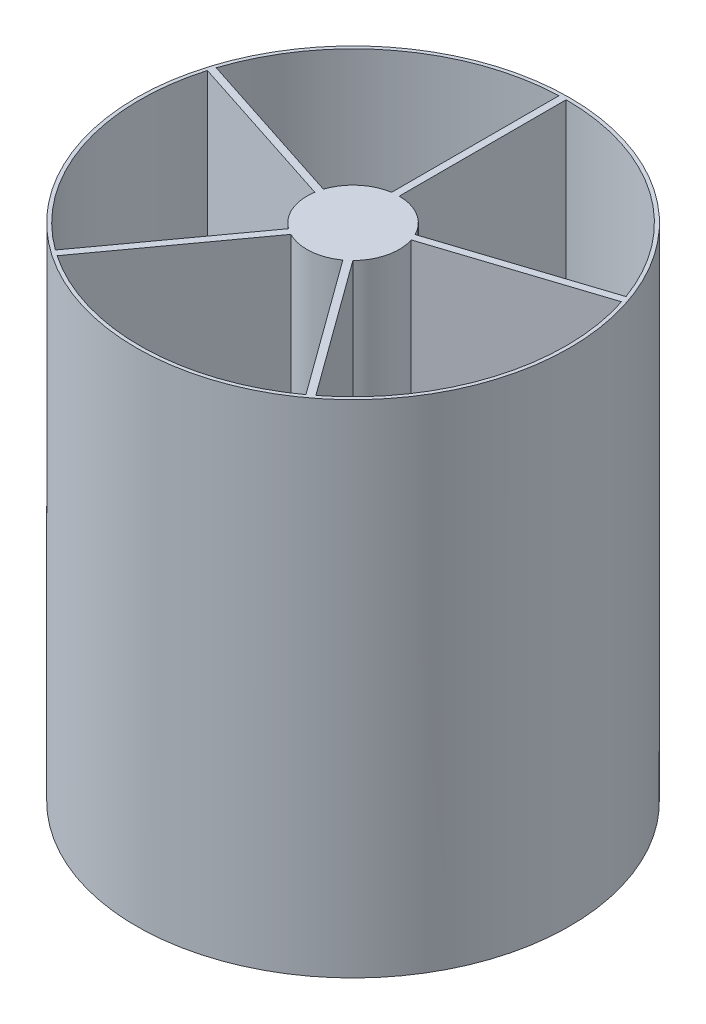
from build123d import *

# Parameters (mm, degrees)
SKETCH3_R           = 305
SKETCH3_R_2         = 300
SKETCH3_R_3         = 65
SKETCH3_R_4         = 60
BOSS_EXTRUDE1_DEPTH = 700
BOSS_EXTRUDE2_START = 5
SKETCH4_R           = 305
BOSS_EXTRUDE2_DEPTH = 5
BOSS_EXTRUDE3_START = -5
SKETCH5_R           = 60
BOSS_EXTRUDE3_DEPTH = 5


with BuildPart() as part:
    # Sketch3 → Boss-Extrude1 (new body)
    # profile 1 of 7: a face of its own
    with BuildSketch(Plane(origin=(0, 0, 0), x_dir=(1, 0, 0), z_dir=(0, 1, 0))):
        with Locations(Location((0, 0, 0), (0, 0, 270))):
            Circle(SKETCH3_R)
        Circle(SKETCH3_R_2, mode=Mode.SUBTRACT)
    # profile 2 of 7: a face of its own
    with BuildSketch(Plane(origin=(0, 0, 0), x_dir=(1, 0, 0), z_dir=(0, 1, 0))):
        with BuildLine():
            Line((184.327754195, -236.692372149), (45.841361304, -46.082204741))
            ThreePointArc((45.841361304, -46.082204741), (42.149337524, -49.48164656), (38.206041399, -52.586104634))
            Line((38.206041399, -52.586104634), (176.335575688, -242.705098312))
            ThreePointArc((176.335575688, -242.705098312), (180.356723189, -239.732042915), (184.327754195, -236.692372149))
        make_face()
    # profile 3 of 7: a face of its own
    with BuildSketch(Plane(origin=(0, 0, 0), x_dir=(1, 0, 0), z_dir=(0, 1, 0))):
        with BuildLine():
            Line((282.068231471, 102.164146329), (57.992540793, 29.35754098))
            ThreePointArc((57.992540793, 29.35754098), (60.084703994, 24.795732413), (61.818673559, 20.086104634))
            Line((61.818673559, 20.086104634), (285.316954889, 92.705098312))
            ThreePointArc((285.316954889, 92.705098312), (283.732014095, 97.44816149), (282.068231471, 102.164146329))
        make_face()
    # profile 4 of 7: a face of its own
    with BuildSketch(Plane(origin=(0, 0, 0), x_dir=(1, 0, 0), z_dir=(0, 1, 0))):
        with BuildLine():
            ThreePointArc((-29.661021416, -57.837909787), (-34.034980801, -55.377071807), (-38.206041399, -52.586104634))
            Line((-38.206041399, -52.586104634), (-176.335575688, -242.705098312))
            ThreePointArc((-176.335575688, -242.705098312), (-172.265429064, -245.610712204), (-168.147414308, -248.448077194))
            Line((-168.147414308, -248.448077194), (-29.661021416, -57.837909787))
        make_face()
    # profile 5 of 7: a face of its own
    with BuildSketch(Plane(origin=(0, 0, 0), x_dir=(1, 0, 0), z_dir=(0, 1, 0))):
        Circle(SKETCH3_R_3)
        with Locations(Location((0, 0, 0), (0, 0, 270))):
            Circle(SKETCH3_R_4, mode=Mode.SUBTRACT)
    # profile 6 of 7: a face of its own
    with BuildSketch(Plane(origin=(0, 0, 0), x_dir=(1, 0, 0), z_dir=(0, 1, 0))):
        with BuildLine():
            ThreePointArc((-64.17288068, 10.336410655), (-63.184112466, 15.256733986), (-61.818673559, 20.086104634))
            Line((-61.818673559, 20.086104634), (-285.316954889, 92.705098312))
            ThreePointArc((-285.316954889, 92.705098312), (-286.822613438, 87.936274772), (-288.248571358, 83.143016003))
            Line((-288.248571358, 83.143016003), (-64.17288068, 10.336410655))
        make_face()
    # profile 7 of 7: a face of its own
    with BuildSketch(Plane(origin=(0, 0, 0), x_dir=(1, 0, 0), z_dir=(0, 1, 0))):
        with BuildLine():
            ThreePointArc((-10, 64.226162893), (-5.014948252, 64.806251967), (0, 65))
            Line((0, 65), (0, 300))
            ThreePointArc((0, 300), (-5.000694782, 299.958318857), (-10, 299.833287011))
            Line((-10, 299.833287011), (-10, 64.226162893))
        make_face()
    extrude(amount=BOSS_EXTRUDE1_DEPTH)

    # Sketch4 → Boss-Extrude2 (add)
    with BuildSketch(Plane.XZ.offset(BOSS_EXTRUDE2_START)):
        with Locations(Location((0, 0, 0), (0, 0, 270))):
            Circle(SKETCH4_R)
    extrude(amount=-BOSS_EXTRUDE2_DEPTH)

    # Sketch5 → Boss-Extrude3 (add)
    with BuildSketch(Plane(origin=(0, 700, 0), x_dir=(1, 0, 0), z_dir=(0, 1, 0)).offset(BOSS_EXTRUDE3_START)):
        with Locations(Location((0, 0, 0), (0, 0, 270))):
            Circle(SKETCH5_R)
    extrude(amount=BOSS_EXTRUDE3_DEPTH)


solid = part.part
